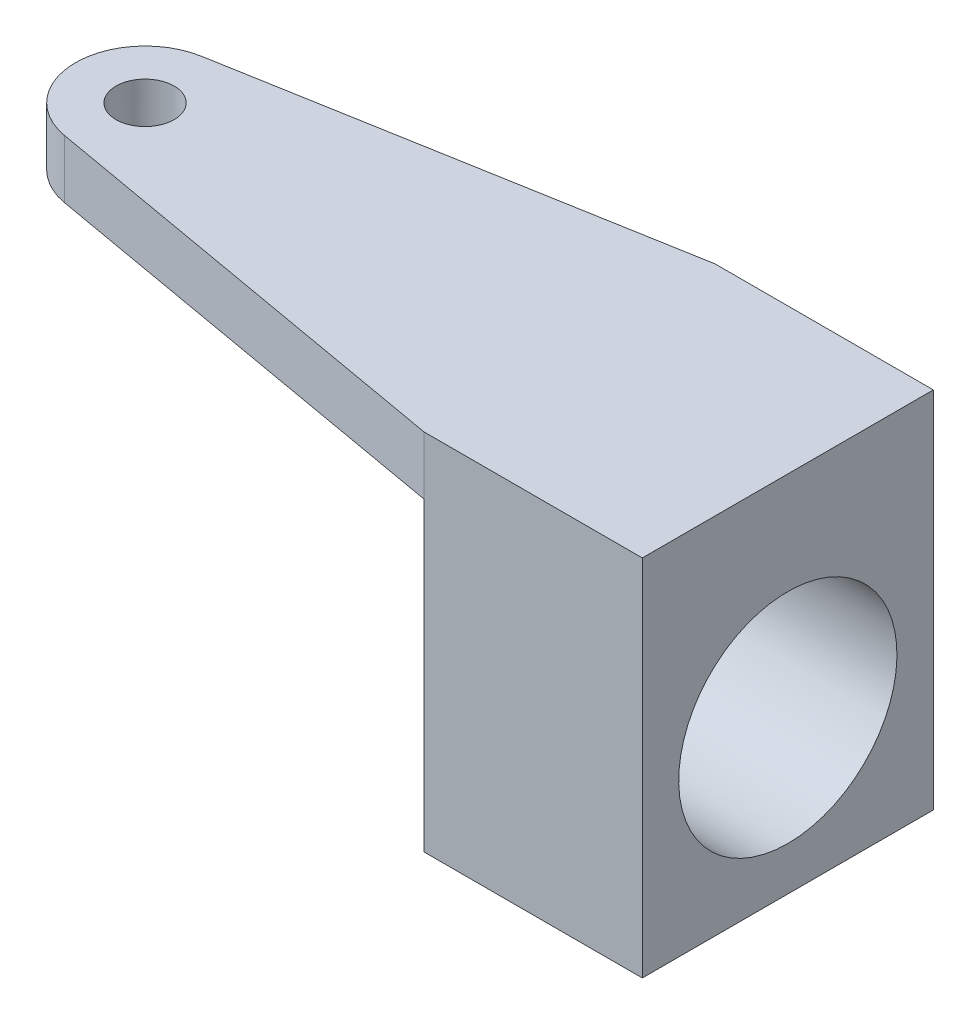
from build123d import *

# Parameters (mm, degrees)
SKETCH1_R           = 10
BOSS_EXTRUDE1_DEPTH = 125
CUT_EXTRUDE1_START  = -105
CUT_EXTRUDE1_DEPTH  = 105
SKETCH5_R           = 37.5
CUT_EXTRUDE2_DEPTH  = 217.665639727


with BuildPart() as part:
    # Sketch1 → Boss-Extrude1 (new body)
    with BuildSketch(Plane(origin=(0, 0, 0), x_dir=(-1, 0, 0), z_dir=(0, -1, 0))):
        with BuildLine():
            Line((-220.847331583, 50), (-145.847331583, 50))
            Line((-145.847331583, 50), (4.152668417, 23.550952894))
            ThreePointArc((4.152668417, 23.550952894), (23.914264304, 0), (4.152668417, -23.550952894))
            Line((4.152668417, -23.550952894), (-145.847331583, -50))
            Line((-145.847331583, -50), (-220.847331583, -50))
            Line((-220.847331583, -50), (-220.847331583, 50))
        make_face()
        with Locations(Location((0, 0, 0), (0, 0, 90))):
            Circle(SKETCH1_R, mode=Mode.SUBTRACT)
    extrude(amount=BOSS_EXTRUDE1_DEPTH)

    # Sketch2 → Cut-Extrude1 (cut)
    with BuildSketch(Plane(origin=(0, -125, 0), x_dir=(-1, 0, 0), z_dir=(0, -1, 0)).offset(CUT_EXTRUDE1_START)):
        with BuildLine():
            Line((-145.847331583, 50), (-145.847331583, -50))
            Line((-145.847331583, -50), (4.152668417, -23.550952894))
            ThreePointArc((4.152668417, -23.550952894), (23.914264304, 0), (4.152668417, 23.550952894))
            Line((4.152668417, 23.550952894), (-145.847331583, 50))
        make_face()
    extrude(amount=CUT_EXTRUDE1_DEPTH, mode=Mode.SUBTRACT)

    # Sketch5 → Cut-Extrude2 (cut, through all)
    with BuildSketch(Plane(origin=(145.847331583, 0, 0), x_dir=(0, 0, -1), z_dir=(-1, 0, 0))):
        with Locations(Location((0, 72.5, 0), (0, 0, 90))):
            Circle(SKETCH5_R)
    extrude(amount=-CUT_EXTRUDE2_DEPTH, mode=Mode.SUBTRACT)


solid = part.part
